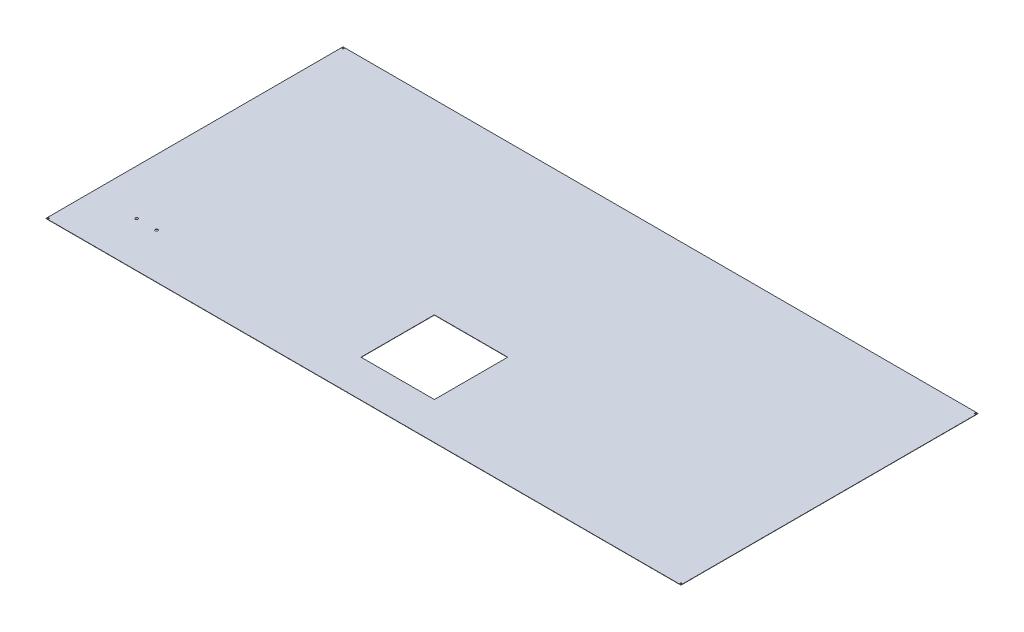
from build123d import *

# Parameters (mm, degrees)
SKETCH1_W                                            = 1212
SKETCH1_H                                            = 567
BOSS_EXTRUDE1_DEPTH                                  = 0.5
CSK_FOR_M1_6_COUNTERSUNK_FLAT_HEAD_SCREW_D           = 1.8
CSK_FOR_M1_6_COUNTERSUNK_FLAT_HEAD_SCREW_DEPTH       = 30
CSK_FOR_M1_6_COUNTERSUNK_FLAT_HEAD_SCREW_CSINK_D     = 3.6
CSK_FOR_M1_6_COUNTERSUNK_FLAT_HEAD_SCREW_CSINK_ANGLE = 90
CSK_FOR_M1_6_COUNTERSUNK_FLAT_HEAD_SCREW_TIP         = 0.540774557
SKETCH4_R                                            = 2.5
CUT_EXTRUDE1_DEPTH                                   = 3
SKETCH5_W                                            = 140
SKETCH5_H                                            = 140
CUT_EXTRUDE2_DEPTH                                   = 7


with BuildPart() as part:
    # Sketch1 → Boss-Extrude1 (new body)
    with BuildSketch(Plane(origin=(0, 0, 0), x_dir=(1, 0, 0), z_dir=(0, 1, 0))):
        with Locations((1295.999999997, 1296)):
            Rectangle(SKETCH1_W, SKETCH1_H)
    extrude(amount=BOSS_EXTRUDE1_DEPTH)

    # CSK for M1.6 Countersunk Flat Head Screw1
    with Locations(Plane(origin=(0, 0.5, 0), x_dir=(1, 0, 0), z_dir=(0, 1, 0))):
        with Locations((1899.999999997, 1577.5), (691.999999997, 1577.5), (691.999999997, 1014.5), (1899.999999997, 1014.5)):
            CounterSinkHole(CSK_FOR_M1_6_COUNTERSUNK_FLAT_HEAD_SCREW_D / 2, CSK_FOR_M1_6_COUNTERSUNK_FLAT_HEAD_SCREW_CSINK_D / 2, depth=CSK_FOR_M1_6_COUNTERSUNK_FLAT_HEAD_SCREW_DEPTH, counter_sink_angle=CSK_FOR_M1_6_COUNTERSUNK_FLAT_HEAD_SCREW_CSINK_ANGLE)
            with Locations((0, 0, -(CSK_FOR_M1_6_COUNTERSUNK_FLAT_HEAD_SCREW_DEPTH + CSK_FOR_M1_6_COUNTERSUNK_FLAT_HEAD_SCREW_TIP / 2))):  # 118° drill point
                Cone(0, CSK_FOR_M1_6_COUNTERSUNK_FLAT_HEAD_SCREW_D / 2, CSK_FOR_M1_6_COUNTERSUNK_FLAT_HEAD_SCREW_TIP, mode=Mode.SUBTRACT)

    # Sketch4 → Cut-Extrude1 (cut)
    with BuildSketch(Plane(origin=(0, 0.5, 0), x_dir=(1, 0, 0), z_dir=(0, 1, 0))):
        with Locations(Location((776.999999997, 1098.5, 0), (0, 0, 270))):
            Circle(SKETCH4_R)
        with Locations(Location((814.999999997, 1098.5, 0), (0, 0, 270))):
            Circle(SKETCH4_R)
    extrude(amount=-CUT_EXTRUDE1_DEPTH, mode=Mode.SUBTRACT)

    # Sketch5 → Cut-Extrude2 (cut)
    with BuildSketch(Plane(origin=(0, 0.5, 0), x_dir=(1, 0, 0), z_dir=(0, 1, 0))):
        with Locations((1290.243608368, 1153.58)):
            Rectangle(SKETCH5_W, SKETCH5_H)
    extrude(amount=-CUT_EXTRUDE2_DEPTH, mode=Mode.SUBTRACT)


solid = part.part
